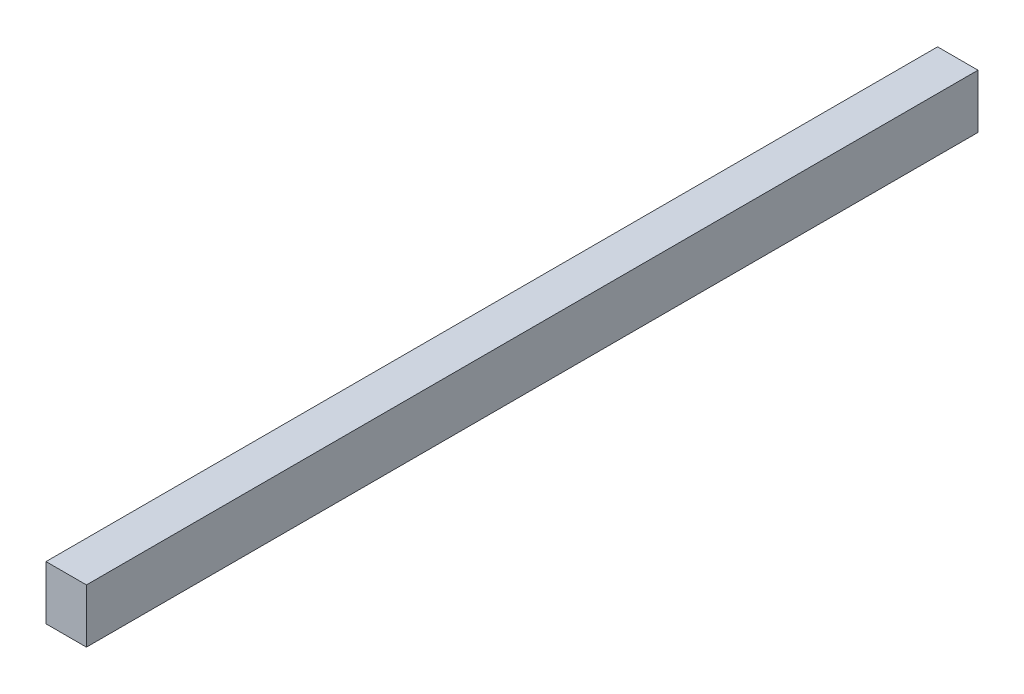
from build123d import *

# Parameters (mm, degrees)
SKETCH1_W           = 76.2
SKETCH1_H           = 101.6
BOSS_EXTRUDE1_DEPTH = 1680


with BuildPart() as part:
    # Sketch1 → Boss-Extrude1 (new body)
    with BuildSketch(Plane.XY):
        with Locations((38.1, 50.8)):
            Rectangle(SKETCH1_W, SKETCH1_H)
    extrude(amount=BOSS_EXTRUDE1_DEPTH)


solid = part.part
